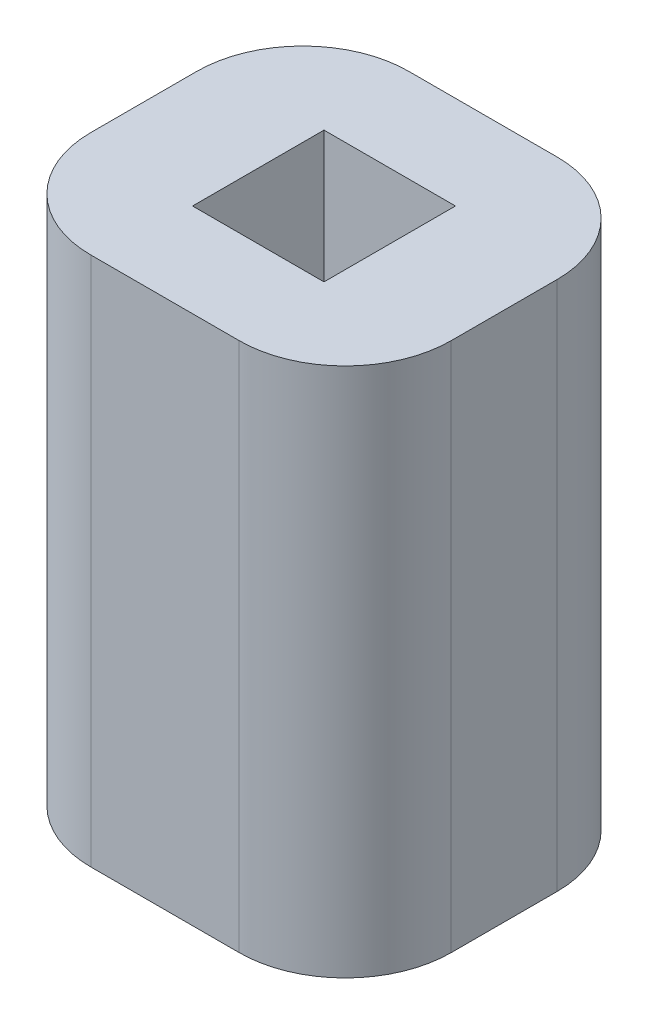
from build123d import *

# Parameters (mm, degrees)
SKETCH1_W           = 17
SKETCH1_H           = 25
BOSS_EXTRUDE1_DEPTH = 15
SKETCH2_W           = 6.2
SKETCH2_H           = 6.2
CUT_EXTRUDE1_DEPTH  = 3.25
SKETCH3_W           = 6.2
SKETCH3_H           = 6.2
CUT_EXTRUDE2_DEPTH  = 3.25
FILLET1_R           = 5
SKETCH6_W           = 6.2
SKETCH6_H           = 6.2
CUT_EXTRUDE3_DEPTH  = 71.704212299


with BuildPart() as part:
    # Sketch1 → Boss-Extrude1 (new body)
    with BuildSketch(Plane.XY):
        with Locations((57.082186124, 39.41449257)):
            Rectangle(SKETCH1_W, SKETCH1_H)
    extrude(amount=BOSS_EXTRUDE1_DEPTH)

    # Sketch2 → Cut-Extrude1 (cut)
    with BuildSketch(Plane.XZ.offset(-26.91449257)):
        with Locations((57.082186124, 7.5)):
            Rectangle(SKETCH2_W, SKETCH2_H)
    extrude(amount=-CUT_EXTRUDE1_DEPTH, mode=Mode.SUBTRACT)

    # Sketch3 → Cut-Extrude2 (cut)
    with BuildSketch(Plane(origin=(0, 51.91449257, 0), x_dir=(1, 0, 0), z_dir=(0, 1, 0))):
        with Locations((57.082186124, -7.5)):
            Rectangle(SKETCH3_W, SKETCH3_H)
    extrude(amount=-CUT_EXTRUDE2_DEPTH, mode=Mode.SUBTRACT)

    # Fillet1
    fillet1_edges = [part.edges().sort_by_distance(p)[0] for p in [
        (48.582186124, 39.41449257, 15),
        (65.582186124, 39.41449257, 15),
        (48.582186124, 39.41449257, 0),
        (65.582186124, 39.41449257, 0),
    ]]
    fillet(fillet1_edges, radius=FILLET1_R)

    # Sketch6 → Cut-Extrude3 (cut, through all)
    with BuildSketch(Plane(origin=(0, 48.66449257, 0), x_dir=(1, 0, 0), z_dir=(0, 1, 0))):
        with Locations((57.082186124, -7.5)):
            Rectangle(SKETCH6_W, SKETCH6_H)
    extrude(amount=-CUT_EXTRUDE3_DEPTH, mode=Mode.SUBTRACT)


solid = part.part
